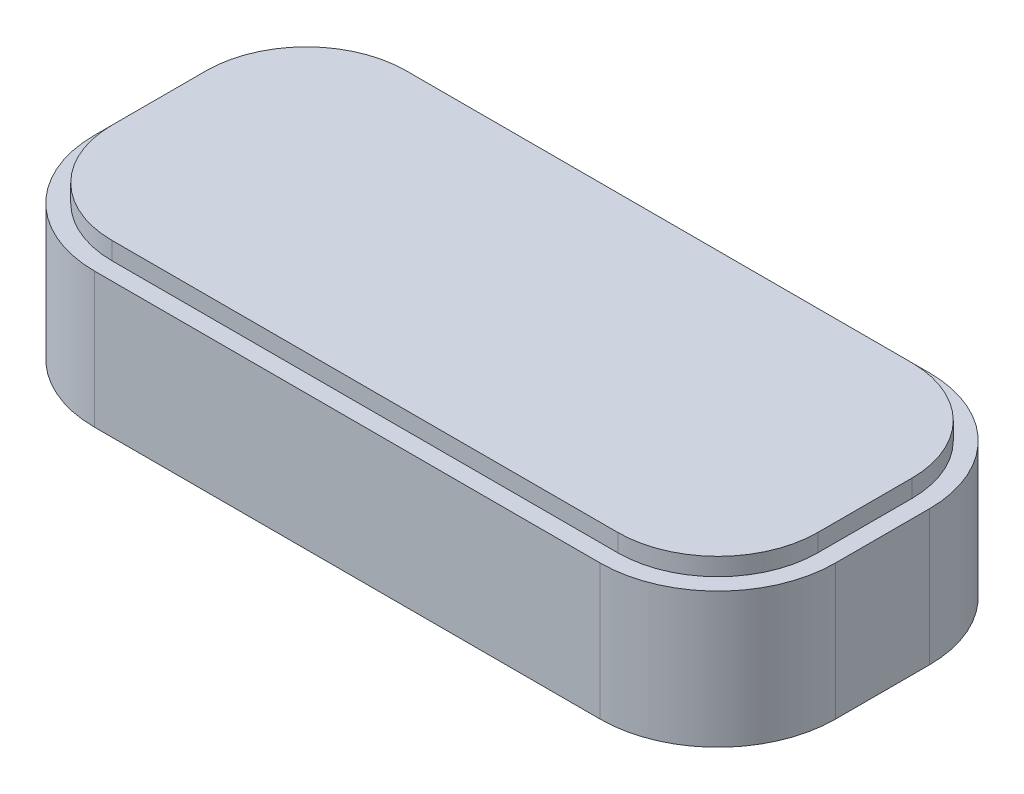
from build123d import *

# Parameters (mm, degrees)
BOSS_EXTRUDE1_DEPTH = 0.5842
BOSS_EXTRUDE2_DEPTH = 0.0762


with BuildPart() as part:
    # Sketch1 → Boss-Extrude1 (new body)
    with BuildSketch(Plane(origin=(0, 0, 0), x_dir=(1, 0, 0), z_dir=(0, 1, 0))):
        with BuildLine():
            Line((-1.6002, 0.2032), (-1.6002, -0.2032))
            ThreePointArc((-1.6002, -0.2032), (-1.451410245, -0.562410245), (-1.0922, -0.7112))
            Line((-1.0922, -0.7112), (1.0922, -0.7112))
            ThreePointArc((1.0922, -0.7112), (1.451410245, -0.562410245), (1.6002, -0.2032))
            Line((1.6002, -0.2032), (1.6002, 0.2032))
            ThreePointArc((1.6002, 0.2032), (1.451410245, 0.562410245), (1.0922, 0.7112))
            Line((1.0922, 0.7112), (-1.0922, 0.7112))
            ThreePointArc((-1.0922, 0.7112), (-1.451410245, 0.562410245), (-1.6002, 0.2032))
        make_face()
    extrude(amount=BOSS_EXTRUDE1_DEPTH)

    # Sketch2 → Boss-Extrude2 (add)
    with BuildSketch(Plane(origin=(0, 0.5842, 0), x_dir=(1, 0, 0), z_dir=(0, 1, 0))):
        with BuildLine():
            Line((-1.524, 0.2032), (-1.524, -0.2032))
            ThreePointArc((-1.524, -0.2032), (-1.397528708, -0.508528708), (-1.0922, -0.635))
            Line((-1.0922, -0.635), (1.0922, -0.635))
            ThreePointArc((1.0922, -0.635), (1.397528708, -0.508528708), (1.524, -0.2032))
            Line((1.524, -0.2032), (1.524, 0.2032))
            ThreePointArc((1.524, 0.2032), (1.397528708, 0.508528708), (1.0922, 0.635))
            Line((1.0922, 0.635), (-1.0922, 0.635))
            ThreePointArc((-1.0922, 0.635), (-1.397528708, 0.508528708), (-1.524, 0.2032))
        make_face()
    extrude(amount=BOSS_EXTRUDE2_DEPTH)


solid = part.part
